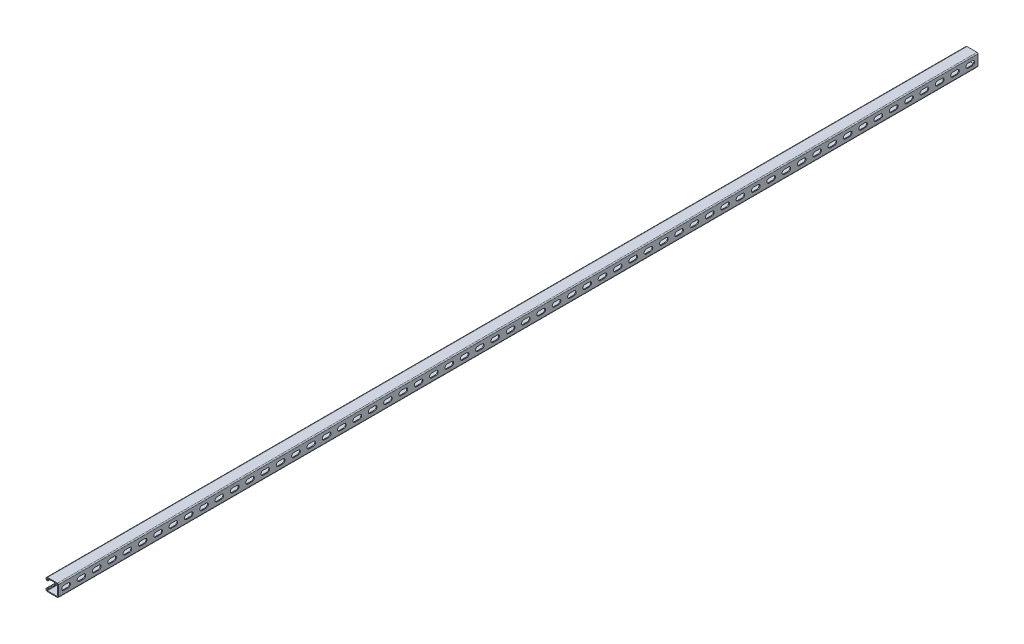
from build123d import *

# Parameters (mm, degrees)
BOSS_EXTRUDE1_DEPTH = 3048
CUT_EXTRUDE1_DEPTH  = 2.794
LPATTERN1_COUNT     = 60
LPATTERN1_PITCH     = 50.8


with BuildPart() as part:
    # Sketch1 → Boss-Extrude1 (new body)
    with BuildSketch(Plane.XY):
        with BuildLine():
            Line((-36.22675, 20.6375), (-3.46075, 20.6375))
            ThreePointArc((-3.46075, 20.6375), (-1.013630207, 19.623869793), (0, 17.17675))
            Line((0, 17.17675), (0, -17.17675))
            ThreePointArc((0, -17.17675), (-1.013630207, -19.623869793), (-3.46075, -20.6375))
            Line((-3.46075, -20.6375), (-36.22675, -20.6375))
            ThreePointArc((-36.22675, -20.6375), (-39.796401808, -19.158901808), (-41.275, -15.58925))
            Line((-41.275, -15.58925), (-41.275, -14.57325))
            ThreePointArc((-41.275, -14.57325), (-40.261369793, -12.126130207), (-37.81425, -11.1125))
            Line((-37.81425, -11.1125), (-35.5346, -11.1125))
            ThreePointArc((-35.5346, -11.1125), (-34.1376, -12.5095), (-35.5346, -13.9065))
            Line((-35.5346, -13.9065), (-37.81425, -13.9065))
            ThreePointArc((-37.81425, -13.9065), (-38.285713446, -14.101786554), (-38.481, -14.57325))
            Line((-38.481, -14.57325), (-38.481, -15.58925))
            ThreePointArc((-38.481, -15.58925), (-37.820745461, -17.183245461), (-36.22675, -17.8435))
            Line((-36.22675, -17.8435), (-3.46075, -17.8435))
            ThreePointArc((-3.46075, -17.8435), (-2.989286554, -17.648213446), (-2.794, -17.17675))
            Line((-2.794, -17.17675), (-2.794, 17.17675))
            ThreePointArc((-2.794, 17.17675), (-2.989286554, 17.648213446), (-3.46075, 17.8435))
            Line((-3.46075, 17.8435), (-36.22675, 17.8435))
            ThreePointArc((-36.22675, 17.8435), (-37.820745461, 17.183245461), (-38.481, 15.58925))
            Line((-38.481, 15.58925), (-38.481, 14.57325))
            ThreePointArc((-38.481, 14.57325), (-38.285713446, 14.101786554), (-37.81425, 13.9065))
            Line((-37.81425, 13.9065), (-35.5346, 13.9065))
            ThreePointArc((-35.5346, 13.9065), (-34.1376, 12.5095), (-35.5346, 11.1125))
            Line((-35.5346, 11.1125), (-37.81425, 11.1125))
            ThreePointArc((-37.81425, 11.1125), (-40.261369793, 12.126130207), (-41.275, 14.57325))
            Line((-41.275, 14.57325), (-41.275, 15.58925))
            ThreePointArc((-41.275, 15.58925), (-39.796401808, 19.158901808), (-36.22675, 20.6375))
        make_face()
    extrude(amount=-BOSS_EXTRUDE1_DEPTH)

    # Sketch2 → Cut-Extrude1 (cut)
    with BuildSketch(Plane(origin=(0, 0, 0), x_dir=(0, 0, -1), z_dir=(1, 0, 0))):
        with BuildLine():
            Line((18.25625, 7.14375), (32.54375, 7.14375))
            ThreePointArc((32.54375, 7.14375), (39.6875, 0), (32.54375, -7.14375))
            Line((32.54375, -7.14375), (18.25625, -7.14375))
            ThreePointArc((18.25625, -7.14375), (11.1125, 0), (18.25625, 7.14375))
        make_face()
    cut_extrude1 = extrude(amount=-CUT_EXTRUDE1_DEPTH, mode=Mode.SUBTRACT)

    # LPattern1: Cut-Extrude1 ×60
    with Locations(*[(0, 0, -i * LPATTERN1_PITCH) for i in range(1, LPATTERN1_COUNT)]):
        add(cut_extrude1, mode=Mode.SUBTRACT)


solid = part.part
